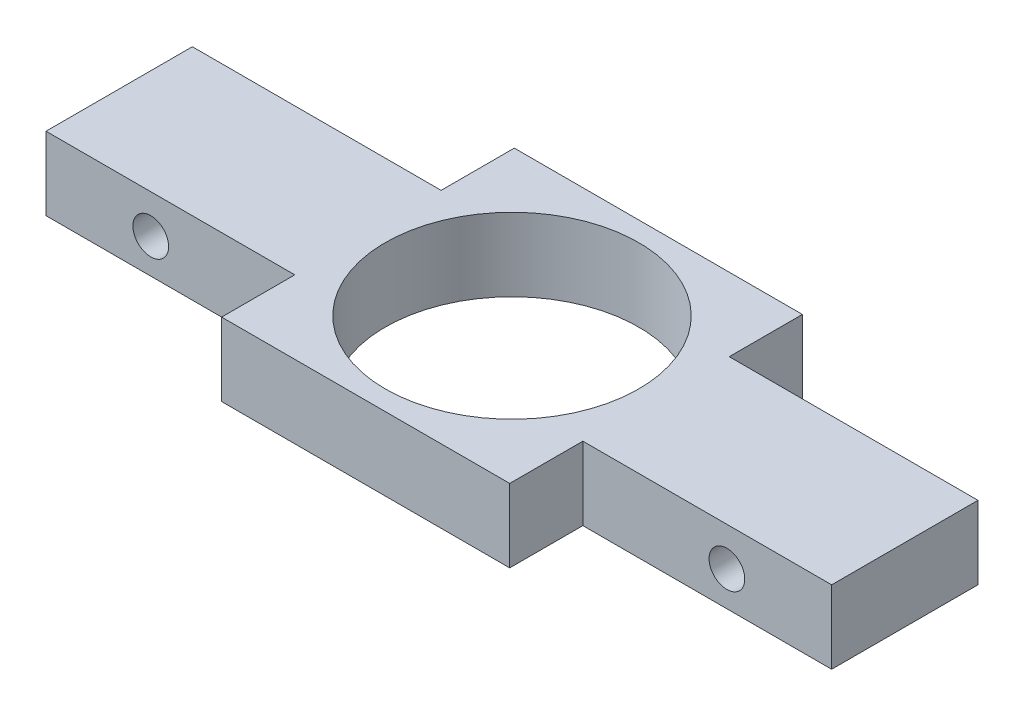
from build123d import *

# Parameters (mm, degrees)
SKETCH1_R               = 11
BOSS_EXTRUDE1_DEPTH     = 6.35
CUT_EXTRUDE1_DEPTH      = 40.56454347
CUT_EXTRUDE1_DEPTH_BACK = 40.56454347
SKETCH2_R               = 1.55


with BuildPart() as part:
    # Sketch1 → Boss-Extrude1 (new body)
    with BuildSketch(Plane(origin=(0, 0, 0), x_dir=(1, 0, 0), z_dir=(0, 1, 0))):
        Polygon((-34.09, 6.35), (-12.5, 6.35), (-12.5, 12.7), (12.5, 12.7), (12.5, 6.35), (34.09, 6.35), (34.09, -6.35), (12.5, -6.35), (12.5, -12.7), (-12.5, -12.7), (-12.5, -6.35), (-34.09, -6.35), align=None)
        with Locations(Location((0, 0, 0), (0, 0, 270))):
            Circle(SKETCH1_R, mode=Mode.SUBTRACT)
    extrude(amount=BOSS_EXTRUDE1_DEPTH)

    # Sketch2 → Cut-Extrude1 (cut, two sides: drawn at the far end of the back side and taken through both)
    with BuildSketch(Plane(origin=(0, 0, -6.35), x_dir=(-1, 0, 0), z_dir=(0, 0, -1)).offset(-CUT_EXTRUDE1_DEPTH_BACK)):
        with Locations((25, 3)):
            Circle(SKETCH2_R)
        with Locations((-25, 3)):
            Circle(SKETCH2_R)
    extrude(amount=CUT_EXTRUDE1_DEPTH + CUT_EXTRUDE1_DEPTH_BACK, mode=Mode.SUBTRACT)


solid = part.part
